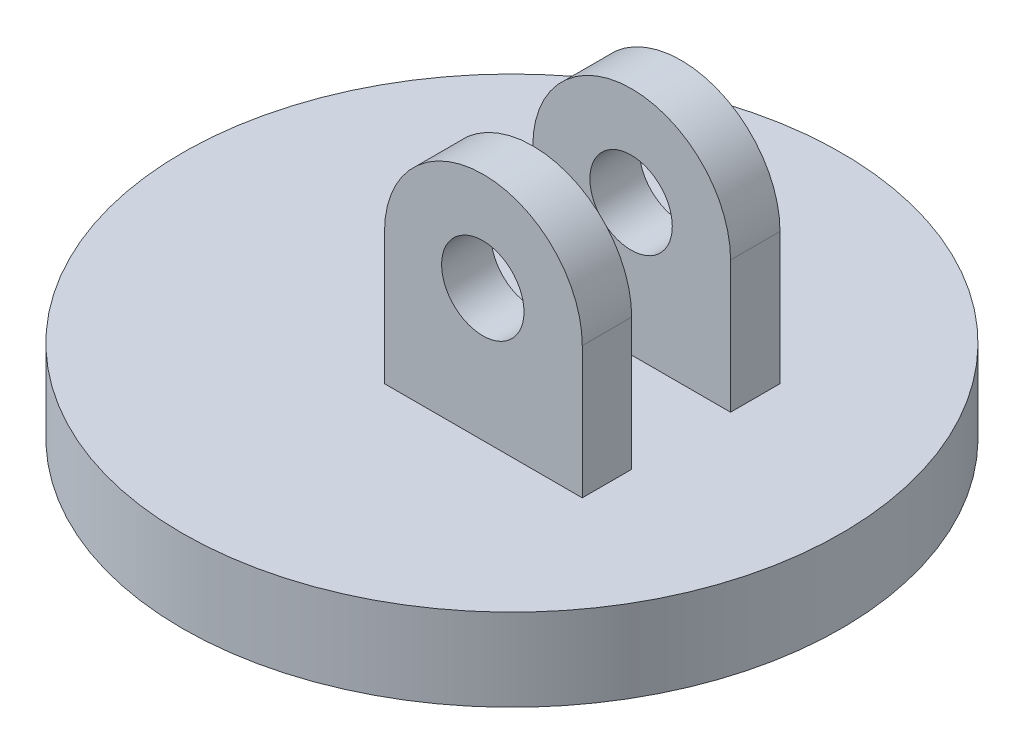
from build123d import *

# Parameters (mm, degrees)
SKETCH3_R               = 2000
BOSS_EXTRUDE1_DEPTH     = 500
SKETCH4_W               = 1200
SKETCH4_H               = 300
BOSS_EXTRUDE2_DEPTH     = 800
BOSS_EXTRUDE3_DEPTH     = 300
SKETCH11_W              = 1200
SKETCH11_H              = 300
BOSS_EXTRUDE4_DEPTH     = 800
BOSS_EXTRUDE5_DEPTH     = 300
CUT_EXTRUDE1_DEPTH      = 3791.778284205
CUT_EXTRUDE1_DEPTH_BACK = 3791.778284205
SKETCH13_R              = 250


with BuildPart() as part:
    # Sketch3 → Boss-Extrude1 (new body)
    with BuildSketch(Plane(origin=(0, 0, 0), x_dir=(1, 0, 0), z_dir=(0, 1, 0))):
        with Locations(Location((0, 0, 0), (0, 0, 270))):
            Circle(SKETCH3_R)
    extrude(amount=BOSS_EXTRUDE1_DEPTH)

    # Sketch4 → Boss-Extrude2 (add)
    with BuildSketch(Plane(origin=(0, 500, 0), x_dir=(1, 0, 0), z_dir=(0, 1, 0))):
        with Locations((426.794885591, 450)):
            Rectangle(SKETCH4_W, SKETCH4_H)
    extrude(amount=BOSS_EXTRUDE2_DEPTH)

    # Sketch6 → Boss-Extrude3 (add)
    with BuildSketch(Plane.XY.offset(-300)):
        with BuildLine():
            Line((-173.205114409, 500), (1026.794885591, 500))
            Line((1026.794885591, 500), (1026.794885591, 1300))
            ThreePointArc((1026.794885591, 1300), (426.794885591, 1900), (-173.205114409, 1300))
            Line((-173.205114409, 1300), (-173.205114409, 500))
        make_face()
    extrude(amount=-BOSS_EXTRUDE3_DEPTH)

    # Sketch11 → Boss-Extrude4 (add)
    with BuildSketch(Plane(origin=(0, 500, 0), x_dir=(1, 0, 0), z_dir=(0, 1, 0))):
        with Locations((426.794885591, -450)):
            Rectangle(SKETCH11_W, SKETCH11_H)
    extrude(amount=BOSS_EXTRUDE4_DEPTH)

    # Sketch12 → Boss-Extrude5 (add)
    with BuildSketch(Plane.XY.offset(600)):
        with BuildLine():
            Line((-173.205114409, 1300), (1026.794885591, 1300))
            ThreePointArc((1026.794885591, 1300), (426.794885591, 1900), (-173.205114409, 1300))
        make_face()
    extrude(amount=-BOSS_EXTRUDE5_DEPTH)

    # Sketch13 → Cut-Extrude1 (cut, two sides: drawn at the far end of the back side and taken through both)
    with BuildSketch(Plane.XY.offset(600).offset(-CUT_EXTRUDE1_DEPTH_BACK)):
        with Locations((423.16346406, 1300.010989453)):
            Circle(SKETCH13_R)
    extrude(amount=CUT_EXTRUDE1_DEPTH + CUT_EXTRUDE1_DEPTH_BACK, mode=Mode.SUBTRACT)


solid = part.part
